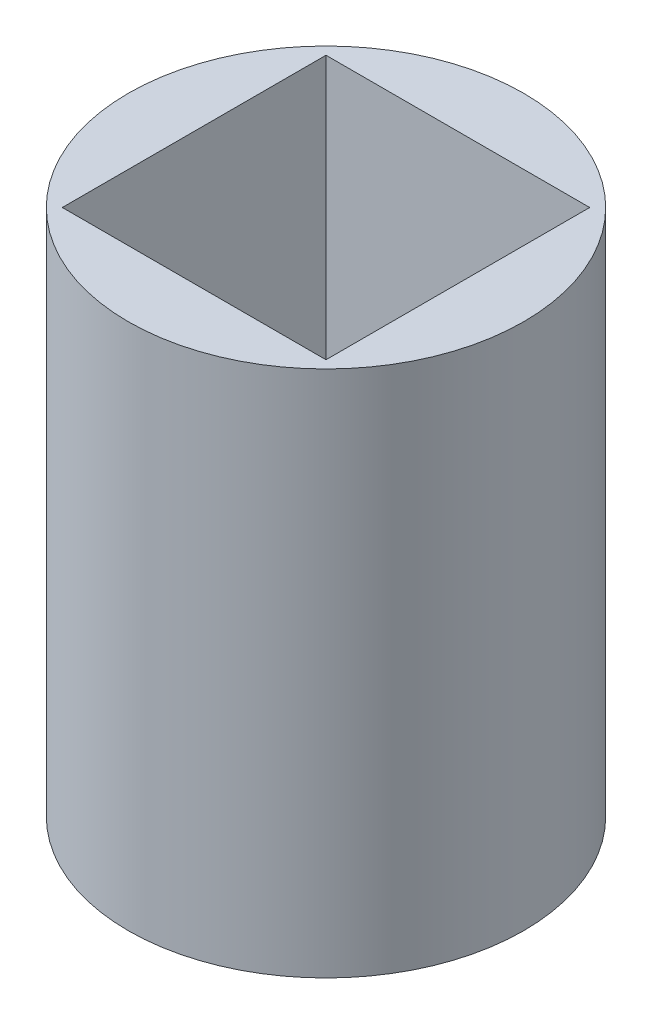
from build123d import *

# Parameters (mm, degrees)
SKETCH1_R           = 2.25
BOSS_EXTRUDE1_DEPTH = 6
SKETCH2_W           = 3
SKETCH2_H           = 3
CUT_EXTRUDE1_DEPTH  = 7.791538854


with BuildPart() as part:
    # Sketch1 → Boss-Extrude1 (new body)
    with BuildSketch(Plane(origin=(0, 0, 0), x_dir=(1, 0, 0), z_dir=(0, 1, 0))):
        with Locations(Location((0, 0, 0), (0, 0, 270))):
            Circle(SKETCH1_R)
    extrude(amount=BOSS_EXTRUDE1_DEPTH)

    # Sketch2 → Cut-Extrude1 (cut, through all)
    with BuildSketch(Plane(origin=(0, 6, 0), x_dir=(1, 0, 0), z_dir=(0, 1, 0))):
        Rectangle(SKETCH2_W, SKETCH2_H)
    extrude(amount=-CUT_EXTRUDE1_DEPTH, mode=Mode.SUBTRACT)


solid = part.part
